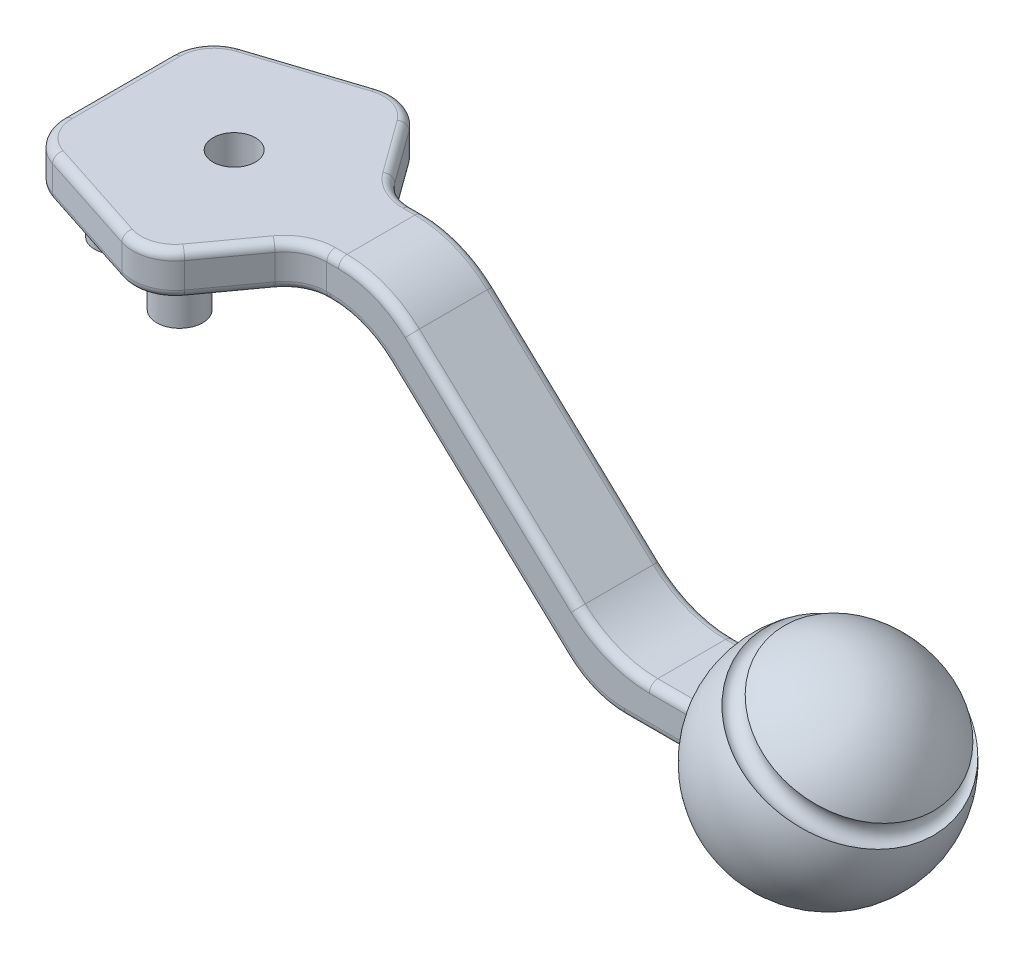
from build123d import *
from build123d.topology import SkipClean

# Parameters (mm, degrees)
BOSS_EXTRUDE1_DEPTH = 12.7
FILLET5_R           = 31.75
FILLET6_R           = 25.4
BOSS_EXTRUDE2_DEPTH = 12.7
CUT_EXTRUDE1_DEPTH  = 240.290924276
BOSS_EXTRUDE3_START = -12.7
SKETCH5_4_R         = 6.35
SKETCH5_4_R_2       = 6.875407659
BOSS_EXTRUDE3_DEPTH = 12.7
FILLET7_R           = 12.7
FILLET2_R           = 2.54
SKETCH7_R           = 3.175


with BuildPart() as part:
    # Sketch1 → Revolve1 (revolve)
    with SkipClean():  # the faces are left unmerged after this step: merging them gives an invalid solid
        with BuildSketch(Plane(origin=(0, 0, 0), x_dir=(1, 0, 0), z_dir=(0, 1, 0))):
            with BuildLine():
                ThreePointArc((31.75, 0), (22.450640303, 22.450640303), (0, 31.75))
                Line((0, 31.75), (0, -31.75))
                ThreePointArc((0, -31.75), (22.450640303, -22.450640303), (31.75, 0))
            make_face()
            with BuildLine():
                Line((0, -31.75), (0, 31.75))
                ThreePointArc((0, 31.75), (-31.75, 0), (0, -31.75))
            make_face()
        revolve(axis=Axis((0, 0, -31.75), (0, 0, 1)))


with BuildPart() as body_2:
    # Sketch4 → Boss-Extrude1 (new, symmetric)
    with BuildSketch(Plane.XY):
        Polygon((0, 6.35), (-31.108519733, 6.35), (-53.34, 6.35), (-121.3358, 69.85), (-177.8, 69.85), (-177.8, 57.15), (-126.343820138, 57.15), (-58.348020138, -6.35), (-31.108519733, -6.35), (0, -6.35), (0, 0), align=None)
    extrude(amount=BOSS_EXTRUDE1_DEPTH, both=True)


with BuildPart() as part_1:
    add(part.part)

    # Combine2: union body 2
    add(body_2.part)

    # Fillet5
    fillet5_edges = [part_1.edges().sort_by_distance(p)[0] for p in [
        (-121.3358, 69.85, 0),
        (-53.34, 6.35, 0),
    ]]
    fillet(fillet5_edges, radius=FILLET5_R)

    # Fillet6
    fillet6_edges = [part_1.edges().sort_by_distance(p)[0] for p in [
        (-126.343820138, 57.15, 0),
        (-58.348020138, -6.35, 0),
    ]]
    fillet(fillet6_edges, radius=FILLET6_R)

    # Sketch5 → Boss-Extrude2 (add)
    with SkipClean():  # the faces are left unmerged after this step: merging them gives an invalid solid
        with BuildSketch(Plane(origin=(0, 69.85, 0), x_dir=(1, 0, 0), z_dir=(0, 1, 0))):
            Polygon((-134.630325886, 0), (-164.459837057, 41.056799873), (-212.725, 25.374497791), (-212.725, -25.374497791), (-164.459837057, -41.056799873), align=None)
        extrude(amount=-BOSS_EXTRUDE2_DEPTH)

    # Sketch5<3> → Cut-Extrude1 (cut, through all)
    with SkipClean():  # the faces are left unmerged after this step: merging them gives an invalid solid
        with BuildSketch(Plane(origin=(0, 69.85, 0), x_dir=(1, 0, 0), z_dir=(0, 1, 0))):
            with BuildLine():
                ThreePointArc((-171.45, 0), (-173.309871939, 4.490128061), (-177.8, 6.35))
                Line((-177.8, 6.35), (-177.8, -6.35))
                ThreePointArc((-177.8, -6.35), (-173.309871939, -4.490128061), (-171.45, 0))
            make_face()
            with BuildLine():
                Line((-177.8, -6.35), (-177.8, 6.35))
                ThreePointArc((-177.8, 6.35), (-184.15, 0), (-177.8, -6.35))
            make_face()
        extrude(amount=-CUT_EXTRUDE1_DEPTH, mode=Mode.SUBTRACT)

    # Sketch5<4> → Boss-Extrude3 (add)
    with SkipClean():  # the faces are left unmerged after this step: merging them gives an invalid solid
        with BuildSketch(Plane(origin=(0, 69.85, 0), x_dir=(1, 0, 0), z_dir=(0, 1, 0)).offset(BOSS_EXTRUDE3_START)):
            with Locations((-169.950968343, 24.156835514)):
                Circle(SKETCH5_4_R)
            with Locations((-198.349031657, 14.929745408)):
                Circle(SKETCH5_4_R)
            with Locations((-198.349031657, -14.929745408)):
                Circle(SKETCH5_4_R)
            with Locations((-169.950968343, -24.156835514)):
                Circle(SKETCH5_4_R_2)
        extrude(amount=-BOSS_EXTRUDE3_DEPTH)

    # Fillet7
    fillet7_edges = [part_1.edges().sort_by_distance(p)[0] for p in [
        (-164.459837057, 63.5, -41.056799873),
        (-143.857415991, 63.5, -12.7),
        (-212.725, 63.5, -25.374497791),
        (-212.725, 63.5, 25.374497791),
        (-164.459837057, 63.5, 41.056799873),
        (-143.857415991, 63.5, 12.7),
    ]]
    fillet(fillet7_edges, radius=FILLET7_R)

    # Fillet2
    fillet2_edges = [part_1.edges().sort_by_distance(p)[0] for p in [
        (-153.348624091, 57.15, -25.763527232),
        (-153.348624091, 69.85, -25.763527232),
        (-188.592418529, 69.85, -33.215648832),
        (-212.725, 69.85, 0),
        (-188.592418529, 69.85, 33.215648832),
        (-153.348624091, 69.85, 25.763527232),
        (-165.386289571, 69.85, 38.205472221),
        (-210.299515829, 69.85, 23.612280389),
        (-210.299515829, 69.85, -23.612280389),
        (-165.386289571, 69.85, -38.205472221),
        (-188.592418529, 57.15, -33.215648832),
        (-153.348624091, 57.15, 25.763527232),
        (-188.592418529, 57.15, 33.215648832),
        (-212.725, 57.15, 0),
        (-165.386289571, 57.15, 38.205472221),
        (-210.299515829, 57.15, 23.612280389),
        (-210.299515829, 57.15, -23.612280389),
        (-165.386289571, 57.15, -38.205472221),
        (-143.15212213, 69.85, -14.084217143),
        (-143.15212213, 57.15, -14.084217143),
        (-143.15212213, 69.85, 14.084217143),
        (-143.15212213, 57.15, 14.084217143),
        (-87.3379, 38.1, -12.7),
        (-87.3379, 38.1, 12.7),
        (-34.609006484, 6.35, -12.7),
        (-34.609006484, 6.35, 12.7),
        (-135.621146565, 69.85, -12.7),
        (-135.621146565, 69.85, 12.7),
        (-122.20865166, 67.636507288, -12.7),
        (-122.20865166, 67.636507288, 12.7),
        (-52.46714834, 8.563492712, -12.7),
        (-52.46714834, 8.563492712, 12.7),
        (-92.345920138, 25.4, -12.7),
        (-136.873151599, 57.15, -12.7),
        (-57.649738811, -4.57920583, -12.7),
        (-92.345920138, 25.4, 12.7),
        (-136.873151599, 57.15, 12.7),
        (-57.649738811, -4.57920583, 12.7),
        (-127.042101466, 55.37920583, -12.7),
        (-127.042101466, 55.37920583, 12.7),
        (-38.365021588, -6.35, 12.7),
        (-38.365021588, -6.35, -12.7),
    ]]
    fillet(fillet2_edges, radius=FILLET2_R)

    # Sketch7 → Cut-Revolve1 (revolve, cut)
    with SkipClean():  # the faces are left unmerged after this step: merging them gives an invalid solid
        with BuildSketch(Plane.XY, mode=Mode.PRIVATE) as cut_revolve1_sk:
            with Locations((-15.875, 27.49630657)):
                Circle(SKETCH7_R)
        revolve(cut_revolve1_sk.sketch.rotate(Axis((0, 0, 0), (0.5000000000000011, 0.8660254037844382, 0)), 180), axis=Axis((0, 0, 0), (0.5000000000000011, 0.8660254037844382, 0)), mode=Mode.SUBTRACT)


solid = part_1.part
